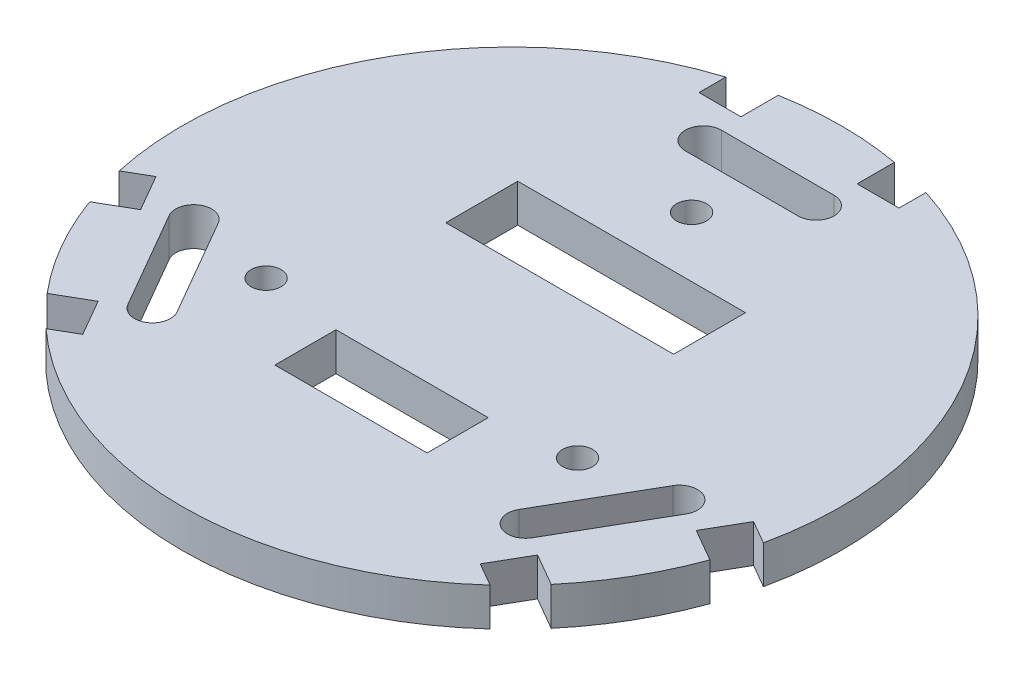
from build123d import *

# Parameters (mm, degrees)
SKETCH2_R           = 27.5
BOSS_EXTRUDE1_DEPTH = 3.175
SKETCH3_R           = 1.5
SKETCH3_R_2         = 1.25
SKETCH3_W           = 3.81
SKETCH3_H           = 1.5
CUT_EXTRUDE1_DEPTH  = 3.175
SKETCH4_W           = 3.5
SKETCH4_H           = 4.54
CUT_EXTRUDE2_DEPTH  = 10
SKETCH5_W           = 19
SKETCH5_H           = 6
SKETCH5_W_2         = 12.7
SKETCH5_H_2         = 5.1
CUT_EXTRUDE3_DEPTH  = 10


with BuildPart() as part:
    # Sketch2 → Boss-Extrude1 (new body)
    with BuildSketch(Plane(origin=(0, 0, 0), x_dir=(1, 0, 0), z_dir=(0, 1, 0))):
        with Locations(Location((0, 0, 0), (0, 0, 270))):
            Circle(SKETCH2_R)
    extrude(amount=BOSS_EXTRUDE1_DEPTH)

    # Sketch3 → Cut-Extrude1 (cut)
    with BuildSketch(Plane(origin=(0, 3.175, 0), x_dir=(1, 0, 0), z_dir=(0, 1, 0))):
        with Locations((-4.7, 20.68)):
            Circle(SKETCH3_R)
        with Locations(Location((0, 15, 0), (0, 0, 270))):
            Circle(SKETCH3_R_2)
        with Locations(Location((-12.990381057, -7.5, 0), (0, 0, 270))):
            Circle(SKETCH3_R_2)
        with Locations(Location((12.990381057, -7.5, 0), (0, 0, 270))):
            Circle(SKETCH3_R_2)
        with BuildLine():
            Line((-1.90505, 20.68), (-1.90505, 22.18))
            Line((-1.90505, 22.18), (-4.7, 22.18))
            ThreePointArc((-4.7, 22.18), (-3.639339828, 21.740660172), (-3.2, 20.68))
            ThreePointArc((-3.2, 20.68), (-3.639339828, 19.619339828), (-4.7, 19.18))
            Line((-4.7, 19.18), (-1.174368952, 19.18))
            ThreePointArc((-1.174368952, 19.18), (-1.71266534, 19.845749619), (-1.90505, 20.68))
        make_face()
        with BuildLine():
            Line((1.90495, 20.68), (-1.90505, 20.68))
            ThreePointArc((-1.90505, 20.68), (-1.71266534, 19.845749619), (-1.174368952, 19.18))
            Line((-1.174368952, 19.18), (1.174268952, 19.18))
            ThreePointArc((1.174268952, 19.18), (1.71256534, 19.845749619), (1.90495, 20.68))
        make_face()
        with Locations((-5e-05, 21.43)):
            Rectangle(SKETCH3_W, SKETCH3_H)
        with BuildLine():
            Line((4.7, 22.18), (1.90495, 22.18))
            Line((1.90495, 22.18), (1.90495, 20.68))
            ThreePointArc((1.90495, 20.68), (1.71256534, 19.845749619), (1.174268952, 19.18))
            Line((1.174268952, 19.18), (4.7, 19.18))
            ThreePointArc((4.7, 19.18), (3.2, 20.68), (4.7, 22.18))
        make_face()
        with Locations((4.7, 20.68)):
            Circle(SKETCH3_R)
        with Locations((-15.55940535, -14.410319398)):
            Circle(SKETCH3_R)
        with BuildLine():
            ThreePointArc((-15.750561777, -11.079226754), (-16.027379451, -11.399040856), (-16.367944576, -11.649888379))
            Line((-16.367944576, -11.649888379), (-18.255879956, -12.739888379))
            Line((-18.255879956, -12.739888379), (-16.858443456, -15.160319398))
            ThreePointArc((-16.858443456, -15.160319398), (-16.30940535, -13.111281292), (-14.260367245, -13.660319398))
            Line((-14.260367245, -13.660319398), (-15.750561777, -11.079226754))
        make_face()
        Polygon((-18.255879956, -12.739888379), (-16.367944576, -11.649888379), (-18.272944576, -8.350331591), (-20.160879956, -9.440331591), align=None)
        with BuildLine():
            Line((-18.272944576, -8.350331591), (-16.367944576, -11.649888379))
            ThreePointArc((-16.367944576, -11.649888379), (-16.027379451, -11.399040856), (-15.750561777, -11.079226754))
            Line((-15.750561777, -11.079226754), (-17.470045712, -8.100993217))
            ThreePointArc((-17.470045712, -8.100993217), (-17.885421686, -8.180817303), (-18.272944576, -8.350331591))
        make_face()
        with BuildLine():
            Line((-20.160879956, -9.440331591), (-18.272944576, -8.350331591))
            ThreePointArc((-18.272944576, -8.350331591), (-17.885421686, -8.180817303), (-17.470045712, -8.100993217))
            Line((-17.470045712, -8.100993217), (-18.960367245, -5.519680602))
            ThreePointArc((-18.960367245, -5.519680602), (-18.810516611, -5.881452035), (-18.75940535, -6.269680602))
            ThreePointArc((-18.75940535, -6.269680602), (-19.871176783, -7.718569342), (-21.558443456, -7.019680602))
            Line((-21.558443456, -7.019680602), (-20.160879956, -9.440331591))
        make_face()
        with Locations((-20.25940535, -6.269680602)):
            Circle(SKETCH3_R)
        with BuildLine():
            ThreePointArc((17.470087928, -8.100920096), (17.888564549, -8.181681202), (18.278613112, -8.353457675))
            Line((18.278613112, -8.353457675), (20.157314831, -9.446506568))
            Line((20.157314831, -9.446506568), (21.558443456, -7.019680602))
            ThreePointArc((21.558443456, -7.019680602), (19.50940535, -7.568718708), (18.960367245, -5.519680602))
            Line((18.960367245, -5.519680602), (17.470087928, -8.100920096))
        make_face()
        Polygon((18.278613112, -8.353457675), (16.362606816, -11.646635452), (18.252304213, -12.746081749), (20.157314831, -9.446506568), align=None)
        with BuildLine():
            Line((18.252304213, -12.746081749), (16.362606816, -11.646635452))
            ThreePointArc((16.362606816, -11.646635452), (16.025165892, -11.396774761), (15.75065718, -11.079061511))
            Line((15.75065718, -11.079061511), (14.260367245, -13.660319398))
            ThreePointArc((14.260367245, -13.660319398), (15.947633918, -12.961430658), (17.05940535, -14.410319398))
            ThreePointArc((17.05940535, -14.410319398), (17.00829409, -14.798547965), (16.858443456, -15.160319398))
            Line((16.858443456, -15.160319398), (18.252304213, -12.746081749))
        make_face()
        with BuildLine():
            ThreePointArc((15.75065718, -11.079061511), (16.025165892, -11.396774761), (16.362606816, -11.646635452))
            Line((16.362606816, -11.646635452), (18.278613112, -8.353457675))
            ThreePointArc((18.278613112, -8.353457675), (17.888564549, -8.181681202), (17.470087928, -8.100920096))
            Line((17.470087928, -8.100920096), (15.75065718, -11.079061511))
        make_face()
        with Locations((15.55940535, -14.410319398)):
            Circle(SKETCH3_R)
        with Locations((20.25940535, -6.269680602)):
            Circle(SKETCH3_R)
    extrude(amount=-CUT_EXTRUDE1_DEPTH, mode=Mode.SUBTRACT)

    # Sketch4 → Cut-Extrude2 (cut)
    with BuildSketch(Plane(origin=(0, 3.175, 0), x_dir=(1, 0, 0), z_dir=(0, 1, 0))):
        Polygon((-27.104160508, -10.054216904), (-23.172405175, -7.784216904), (-24.922405175, -4.753127991), (-28.854160508, -7.023127991), align=None)
        Polygon((-22.259160508, -18.446003067), (-20.509160508, -21.47709198), (-16.577405175, -19.20709198), (-18.327405175, -16.176003067), align=None)
        with Locations((6.594873, 26.23)):
            Rectangle(SKETCH4_W, SKETCH4_H)
        with Locations((-6.595127, 26.23)):
            Rectangle(SKETCH4_W, SKETCH4_H)
        Polygon((22.259287508, -18.445783096), (18.327532175, -16.175783096), (16.577532175, -19.206872009), (20.509287508, -21.476872009), align=None)
        Polygon((27.104287508, -10.053996933), (23.172532175, -7.783996933), (24.922532175, -4.75290802), (28.854287508, -7.02290802), align=None)
    extrude(amount=-CUT_EXTRUDE2_DEPTH, mode=Mode.SUBTRACT)

    # Sketch5 → Cut-Extrude3 (cut)
    with BuildSketch(Plane(origin=(0, 3.175, 0), x_dir=(1, 0, 0), z_dir=(0, 1, 0))):
        with Locations((0, 7)):
            Rectangle(SKETCH5_W, SKETCH5_H)
        with Locations((0, -10.860319398)):
            Rectangle(SKETCH5_W_2, SKETCH5_H_2)
    extrude(amount=-CUT_EXTRUDE3_DEPTH, mode=Mode.SUBTRACT)


solid = part.part
